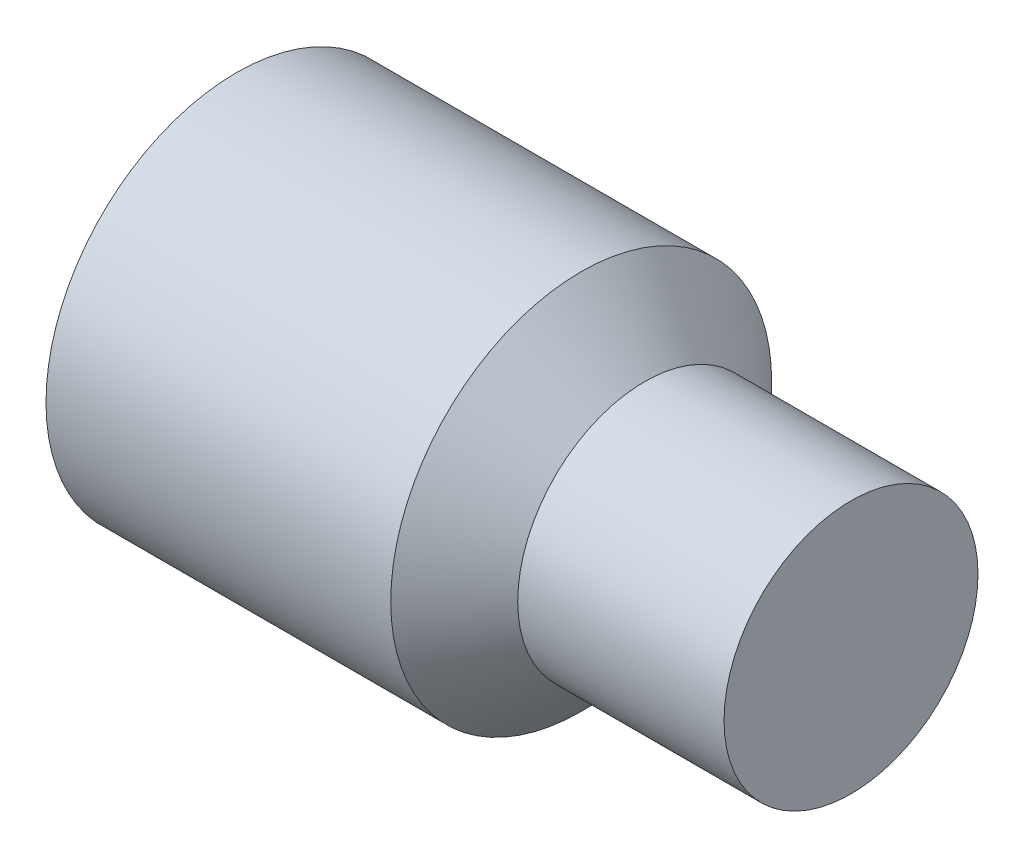
from build123d import *

# Parameters (mm, degrees)
HEX_2_DEPTH = 3.5


with BuildPart() as part:
    # BodySke → BaseBody (revolve)
    with BuildSketch(Plane.XY, mode=Mode.PRIVATE) as basebody_sk:
        Polygon((0, 0), (0, 2.4455), (0.320140724, 3), (5.75, 3), (6.75, 2), (10, 2), (10, 0), align=None)
    revolve(basebody_sk.sketch.rotate(Axis((-12.7, 0, 0), (1, 0, 0)), 90), axis=Axis((-12.7, 0, 0), (1, 0, 0)))

    # Sketch2 → Hex 2 (cut)
    with BuildSketch(Plane.ZY):
        Polygon((0.866025404, 1.5), (-0.866025404, 1.5), (-1.732050808, 0), (-0.866025404, -1.5), (0.866025404, -1.5), (1.732050808, 0), align=None)
    extrude(amount=-HEX_2_DEPTH, mode=Mode.SUBTRACT)


solid = part.part
